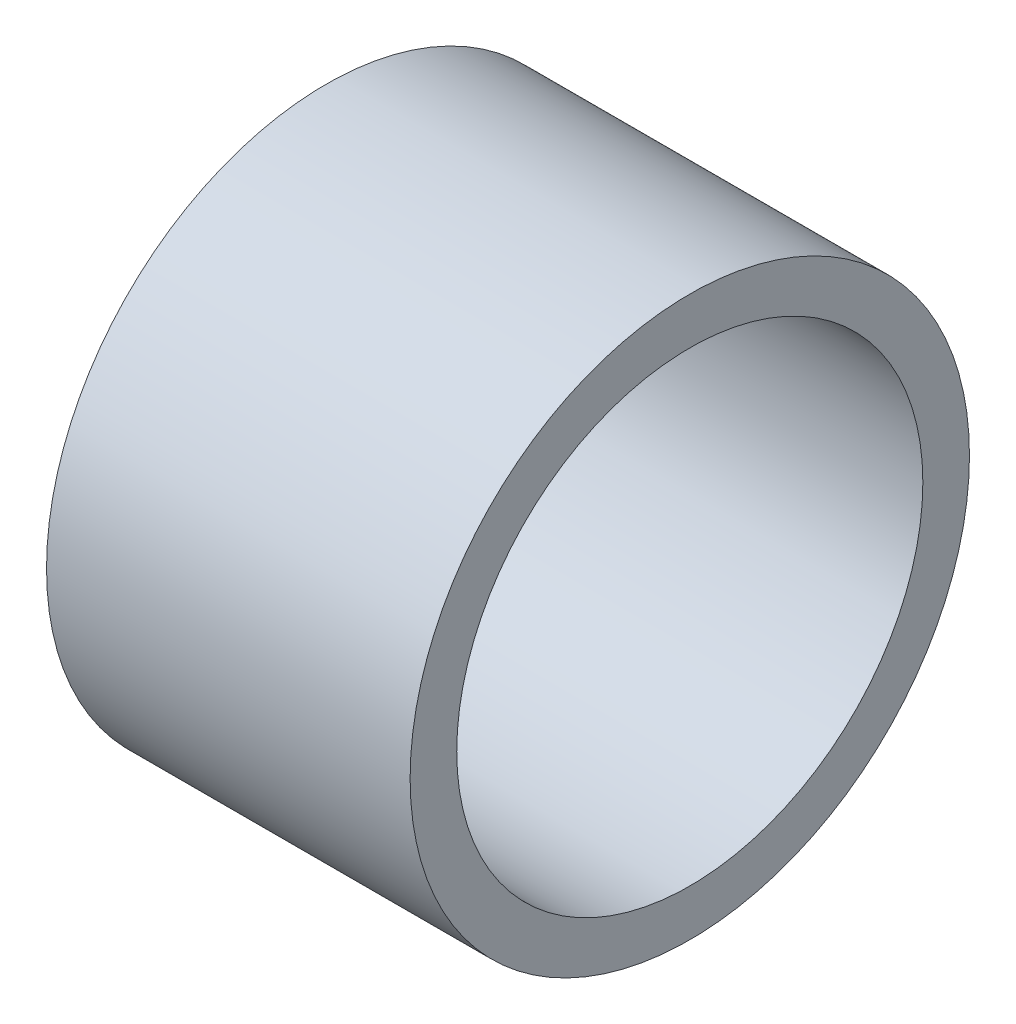
from build123d import *

# Parameters (mm, degrees)
SKETCH1_R           = 6
SKETCH1_R_2         = 5
BOSS_EXTRUDE1_DEPTH = 7.8


with BuildPart() as part:
    # Sketch1 → Boss-Extrude1 (new body)
    with BuildSketch(Plane(origin=(0, 0, 0), x_dir=(0, 0, -1), z_dir=(1, 0, 0))):
        Circle(SKETCH1_R)
        Circle(SKETCH1_R_2, mode=Mode.SUBTRACT)
    extrude(amount=BOSS_EXTRUDE1_DEPTH)


solid = part.part
